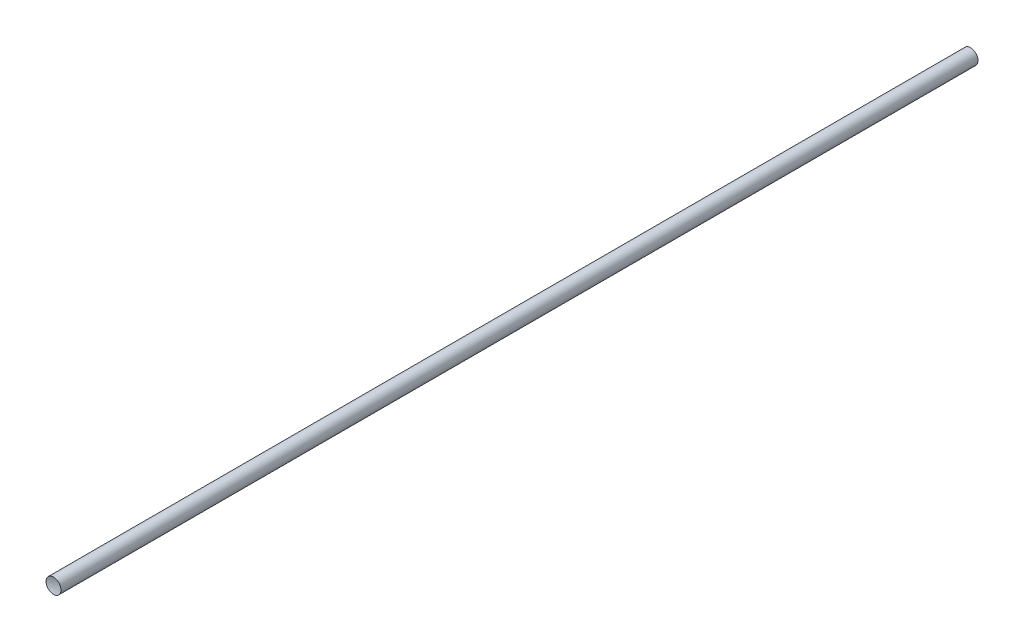
from build123d import *

# Parameters (mm, degrees)
ESQUISSE1_R        = 2
BOSS_EXTRU_1_DEPTH = 128.4


with BuildPart() as part:
    # Esquisse1 → Boss.-Extru.1 (new, symmetric)
    with BuildSketch(Plane.XY):
        Circle(ESQUISSE1_R)
    extrude(amount=BOSS_EXTRU_1_DEPTH, both=True)

    # Esquisse2 → Enlèvement de matière-Révolution1 (revolve, cut)
    with BuildSketch(Plane(origin=(0, 0, 0), x_dir=(1, 0, 0), z_dir=(0, 1, 0))):
        with BuildLine():
            Line((6.35, 128.4), (-6.35, 128.4))
            ThreePointArc((-6.35, 128.4), (-1.17e-15, 122.05000000000001), (6.35, 128.4))
        make_face()
    enl_vement_de_mati_re_r_volution1 = revolve(axis=Axis((6.35, 0, -128.4), (-1, 0, 0)), mode=Mode.SUBTRACT)

    # Symétrie1: Enlèvement de matière-Révolution1 across plane
    add(enl_vement_de_mati_re_r_volution1.mirror(Plane.XY), mode=Mode.SUBTRACT)


solid = part.part
